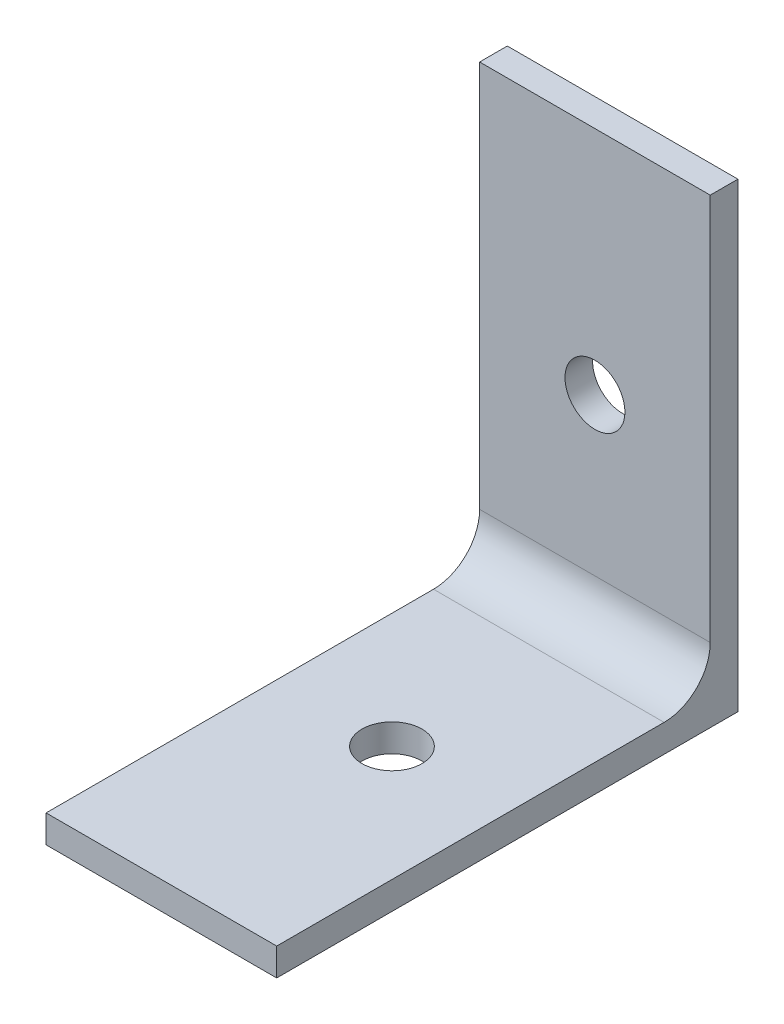
from build123d import *

# Parameters (mm, degrees)
SKETCH2_W           = 12.7
SKETCH2_H           = 23.876
BOSS_EXTRUDE1_DEPTH = 1.524
SKETCH3_W           = 12.7
SKETCH3_H           = 25.4
BOSS_EXTRUDE2_DEPTH = 1.524
FILLET1_R           = 2.54
SKETCH4_R           = 1.651
CUT_EXTRUDE1_DEPTH  = 39.517993004
SKETCH5_R           = 1.651
CUT_EXTRUDE2_DEPTH  = 1.524


with BuildPart() as part:
    # Sketch2 → Boss-Extrude1 (new body)
    with BuildSketch(Plane.XY):
        with Locations((-12.183996683, 11.938)):
            Rectangle(SKETCH2_W, SKETCH2_H)
    extrude(amount=BOSS_EXTRUDE1_DEPTH)

    # Sketch3 → Boss-Extrude2 (add)
    with BuildSketch(Plane.XZ):
        with Locations((-12.183996683, 12.7)):
            Rectangle(SKETCH3_W, SKETCH3_H)
    extrude(amount=BOSS_EXTRUDE2_DEPTH)

    # Fillet1
    fillet1_edges = [part.edges().sort_by_distance(p)[0] for p in [
        (-12.183996683, 0, 1.524),
    ]]
    fillet(fillet1_edges, radius=FILLET1_R)

    # Sketch4 → Cut-Extrude1 (cut, through all)
    with BuildSketch(Plane.XY.offset(1.524)):
        with Locations((-12.183996683, 11.176)):
            Circle(SKETCH4_R)
    extrude(amount=-CUT_EXTRUDE1_DEPTH, mode=Mode.SUBTRACT)

    # Sketch5 → Cut-Extrude2 (cut)
    with BuildSketch(Plane(origin=(0, 0, 0), x_dir=(1, 0, 0), z_dir=(0, 1, 0))):
        with Locations(Location((-12.183996683, -12.7, 0), (0, 0, 180))):
            Circle(SKETCH5_R)
    extrude(amount=-CUT_EXTRUDE2_DEPTH, mode=Mode.SUBTRACT)


solid = part.part
